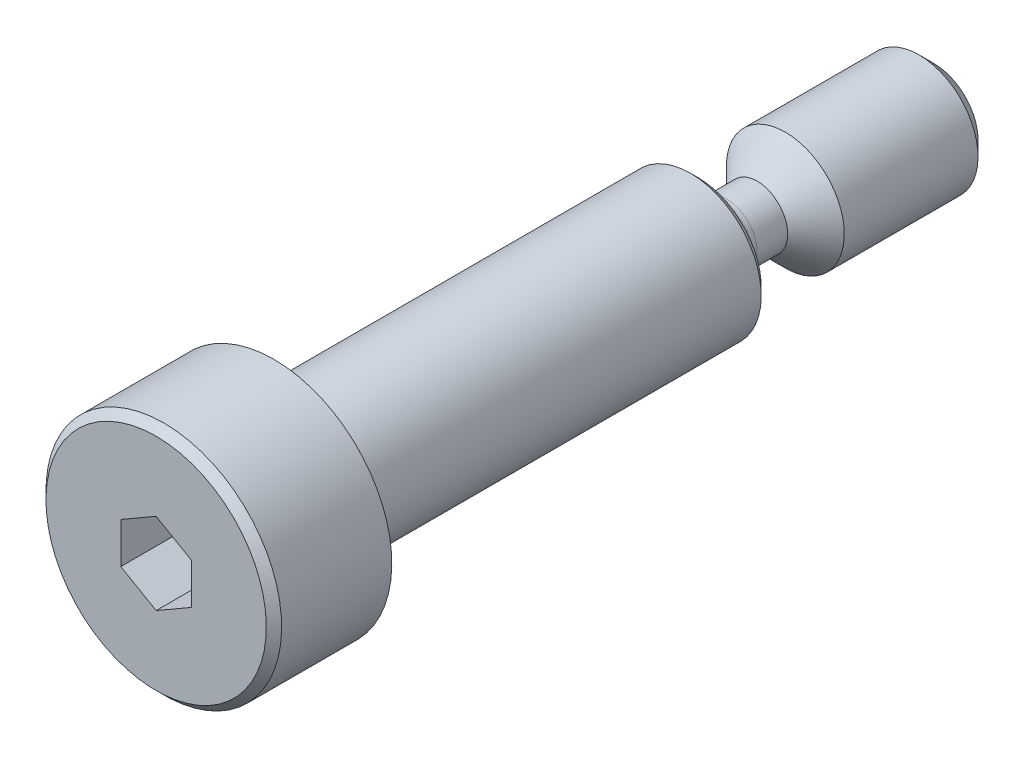
from build123d import *

# Parameters (mm, degrees)
SKETCH4_W          = 0.666666667
SKETCH4_H          = 0.666666667
CHAMFER1_SIZE      = 0.195
CHAMFER2_SIZE      = 0.625
CHAMFER3_SIZE      = 0.325
CUT_EXTRUDE1_DEPTH = 2.5


with BuildPart() as part:
    # Sketch3 → Revolve1 (revolve)
    with BuildSketch(Plane(origin=(0, 0, 0), x_dir=(0, 0, -1), z_dir=(1, 0, 0))):
        Polygon((-16.5, 5), (-11.5, 5), (-11.5, 3), (6.5, 3), (6.5, 2.5), (16.5, 2.5), (16.5, 0), (-16.5, 0), align=None)
    revolve(axis=Axis((0, 0, -16.5), (0, 0, 1)))

    # Sketch4 → Cut-Revolve1 (revolve, cut)
    with BuildSketch(Plane(origin=(0, 0, 0), x_dir=(0, 0, -1), z_dir=(1, 0, 0))):
        with Locations((-11.166666666, 2.666666667)):
            Rectangle(SKETCH4_W, SKETCH4_H)
    revolve(axis=Axis((0, 0, -16.5), (0, 0, 1)), mode=Mode.SUBTRACT)

    # Chamfer1
    chamfer1_edges = [part.edges().sort_by_distance(p)[0] for p in [
        (0, -3, 10.833333333),
        (0, -2.333333333, 10.833333333),
    ]]
    chamfer(chamfer1_edges, length=CHAMFER1_SIZE)

    # Sketch6 → Cut-Revolve2 (revolve, cut)
    with BuildSketch(Plane(origin=(0, 0, 0), x_dir=(0, 0, -1), z_dir=(1, 0, 0))):
        with BuildLine():
            Line((6.5, 3), (10.7, 3))
            Line((10.7, 3), (9, 1.3))
            Line((9, 1.3), (7.7, 1.3))
            ThreePointArc((7.7, 1.3), (6.851471863, 1.651471863), (6.5, 2.5))
            Line((6.5, 2.5), (6.5, 3))
        make_face()
    revolve(axis=Axis((0, 0, -16.5), (0, 0, 1)), mode=Mode.SUBTRACT)

    # Chamfer2
    chamfer2_edges = [part.edges().sort_by_distance(p)[0] for p in [
        (0, -2.5, -16.5),
    ]]
    chamfer(chamfer2_edges, length=CHAMFER2_SIZE)

    # Chamfer3
    chamfer3_edges = [part.edges().sort_by_distance(p)[0] for p in [
        (0, -5, 16.5),
        (0, -3, -6.5),
    ]]
    chamfer(chamfer3_edges, length=CHAMFER3_SIZE)

    # Sketch8 → Cut-Extrude1 (cut)
    with BuildSketch(Plane.XY.offset(16.5)):
        Polygon((1.5, 0.866025404), (0, 1.732050808), (-1.5, 0.866025404), (-1.5, -0.866025404), (0, -1.732050808), (1.5, -0.866025404), align=None)
    extrude(amount=-CUT_EXTRUDE1_DEPTH, mode=Mode.SUBTRACT)


solid = part.part
